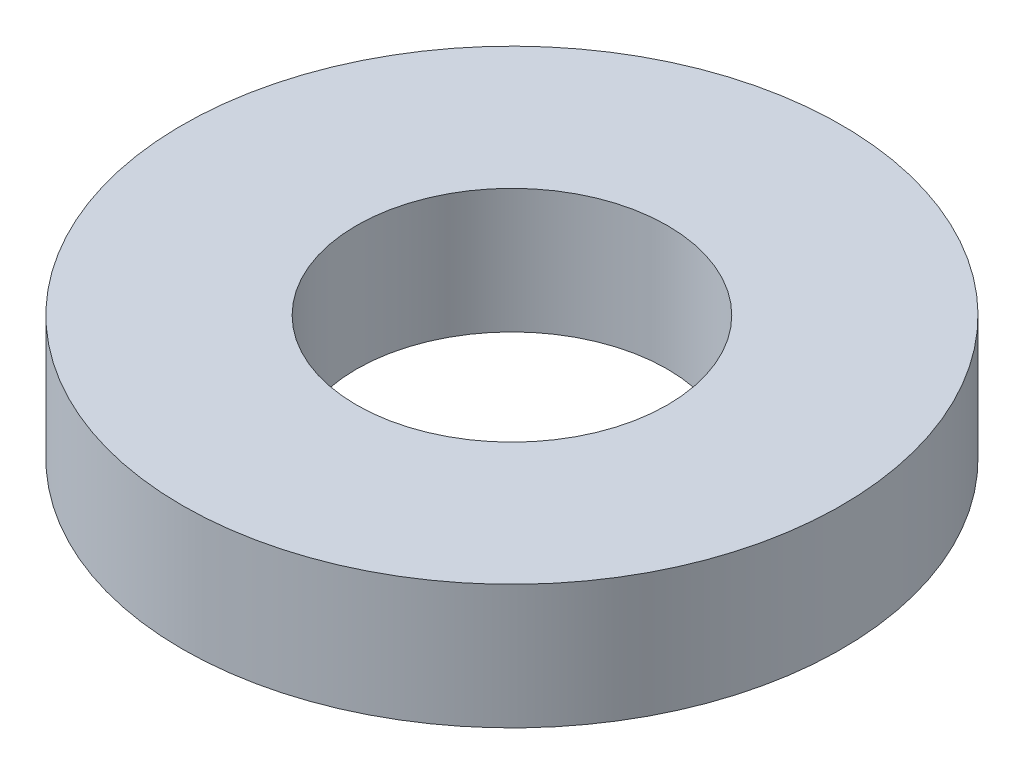
from build123d import *

# Parameters (mm, degrees)
SKETCH1_R                   = 6.731
BOSS_EXTRUDE1_DEPTH         = 2.54
F_1_4_0_25_DIAMETER_HOLE1_D = 6.35


with BuildPart() as part:
    # Sketch1 → Boss-Extrude1 (new body)
    with BuildSketch(Plane(origin=(0, 0, 0), x_dir=(1, 0, 0), z_dir=(0, 1, 0))):
        with Locations(Location((0, 0, 0), (0, 0, 270))):
            Circle(SKETCH1_R)
    extrude(amount=BOSS_EXTRUDE1_DEPTH)

    # 1/4 (0.25) Diameter Hole1 (through all)
    with Locations(Plane(origin=(0, 2.54, 0), x_dir=(1, 0, 0), z_dir=(0, 1, 0))):
        with Locations((0, 0)):
            Hole(F_1_4_0_25_DIAMETER_HOLE1_D / 2)


solid = part.part
